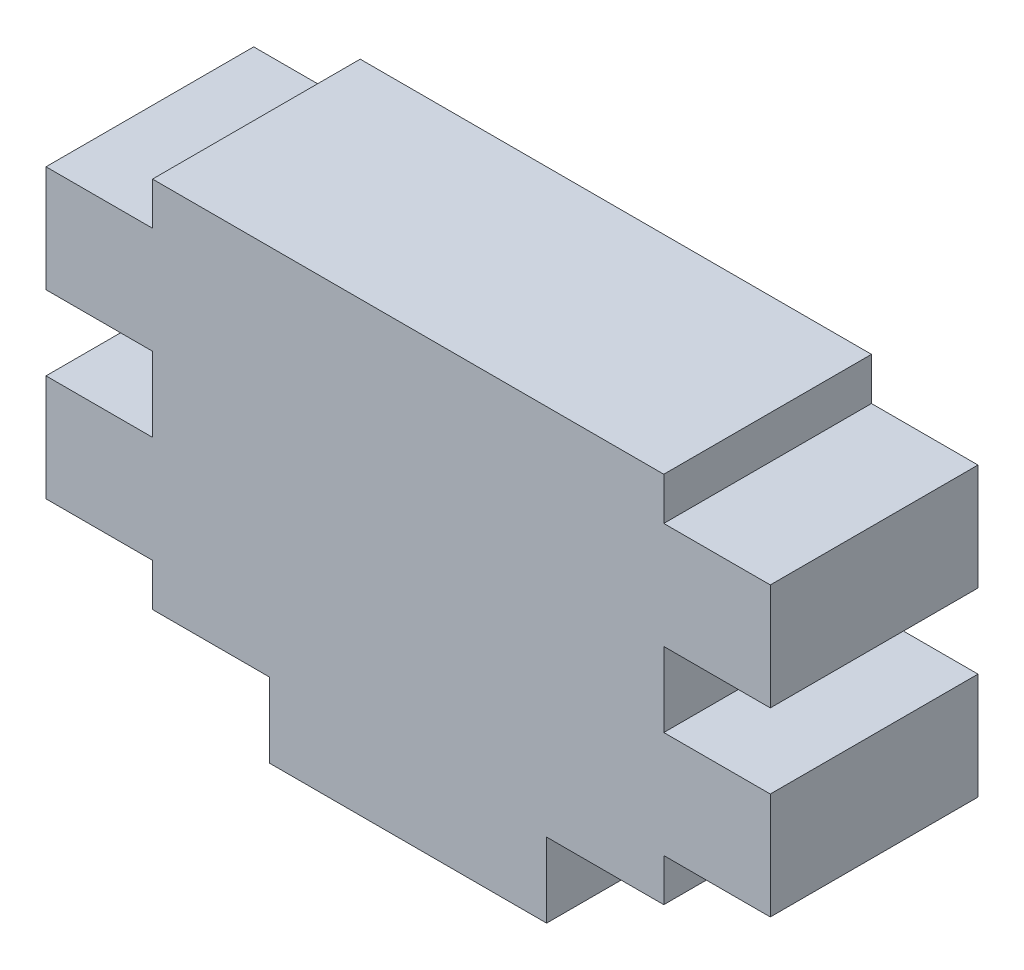
from build123d import *

# Parameters (mm, degrees)
COMPONENT_OUTLINE_DEPTH = 1.95


with BuildPart() as part:
    # 草图1 → Component_Outline (new body)
    with BuildSketch(Plane.XY):
        Polygon((3.400014, -1.349961), (2.399975, -1.350002), (2.399974, -1.749977), (1.29999, -1.750046), (1.299967, -2.449949), (-1.299969, -2.449987), (-1.300039, -1.749977), (-2.400023, -1.750046), (-2.400016, -1.349972), (-3.399955, -1.35002), (-3.399996, -0.349981), (-2.399964, -0.35004), (-2.400034, 0.34997), (-3.399966, 0.350022), (-3.400014, 1.349961), (-2.399975, 1.350002), (-2.399974, 1.749977), (2.400023, 1.750046), (2.400016, 1.349972), (3.399955, 1.35002), (3.399996, 0.349981), (2.399964, 0.35004), (2.400034, -0.34997), (3.399966, -0.350022), align=None)
    extrude(amount=COMPONENT_OUTLINE_DEPTH)


solid = part.part
